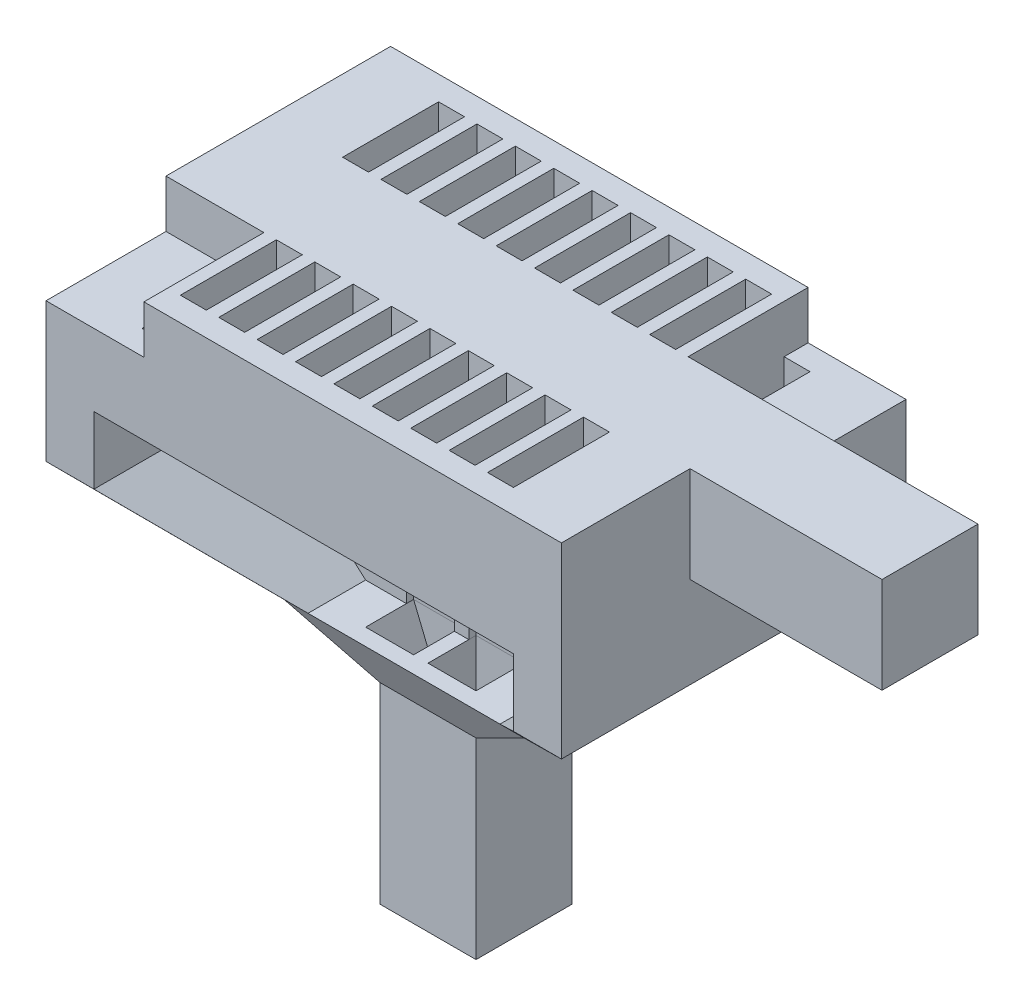
from build123d import *

# Parameters (mm, degrees)
MAIN_BLOCK_W               = 5.37
MAIN_BLOCK_H               = 3.59
MAIN_WELL_BLOCK_DEPTH      = 1.25
WELL_SKETCH_W              = 0.27
WELL_SKETCH_H              = 1
WELLS_DEPTH                = 2.54
SUPPORT_BEAMS_W            = 0.5
SUPPORT_BEAMS_H            = 3.59
SUPPORT_BEAMS_EXTR_DEPTH   = 0.7
WALL_DIVIDER_SKETCH_W      = 4.37
WALL_DIVIDER_SKETCH_H      = 0.3
DIVIDER_WALL_EXTR_DEPTH    = 0.7
LOWER_EXIT_BASE_SKETCH_2_W = 1
LOWER_EXIT_BASE_SKETCH_2_H = 1
TETRODE_GUIDE_TUBE_DEPTH   = 2
MID_TETRODE_HOLES_6_W      = 0.32
MID_TETRODE_HOLES_6_H      = 0.32
CUT_EXTRUDE3_DEPTH         = 2
TETRODE_GUIDE_TOP_8_W      = 0.5
TETRODE_GUIDE_TOP_8_H      = 0.5
CUT_EXTRUDE4_DEPTH         = 0.5
SKETCH9_W                  = 1.020059297
SKETCH9_H                  = 1.25
SKETCH9_W_2                = 1.02
GND_EXTR_DEPTH             = 0.5
SKETCH10_W                 = 1
SKETCH10_H                 = 1
CONNECTOR_ARM_DEPTH        = 2


with BuildPart() as part:
    # main block → Main Well Block (new body)
    with BuildSketch(Plane(origin=(0, 0, 0), x_dir=(1, 0, 0), z_dir=(0, 1, 0))):
        Rectangle(MAIN_BLOCK_W, MAIN_BLOCK_H)
    extrude(amount=-MAIN_WELL_BLOCK_DEPTH)

    # well sketch → wells (cut)
    with BuildSketch(Plane(origin=(0, 0, 0), x_dir=(1, 0, 0), z_dir=(0, 1, 0))):
        with Locations((1.8, 1.045)):
            Rectangle(WELL_SKETCH_W, WELL_SKETCH_H)
        with Locations((1.400006589, 1.045)):
            Rectangle(WELL_SKETCH_W, WELL_SKETCH_H)
        with Locations((1.000013177, 1.045)):
            Rectangle(WELL_SKETCH_W, WELL_SKETCH_H)
        with Locations((0.600019766, 1.045)):
            Rectangle(WELL_SKETCH_W, WELL_SKETCH_H)
        with Locations((0.200026354, 1.045)):
            Rectangle(WELL_SKETCH_W, WELL_SKETCH_H)
        with Locations((-0.199967057, 1.045)):
            Rectangle(WELL_SKETCH_W, WELL_SKETCH_H)
        with Locations((-0.599960468, 1.045)):
            Rectangle(WELL_SKETCH_W, WELL_SKETCH_H)
        with Locations((-0.99995388, 1.045)):
            Rectangle(WELL_SKETCH_W, WELL_SKETCH_H)
        with Locations((-1.399947291, 1.045)):
            Rectangle(WELL_SKETCH_W, WELL_SKETCH_H)
        with Locations((-1.799940703, 1.045)):
            Rectangle(WELL_SKETCH_W, WELL_SKETCH_H)
        with Locations((1.400006589, -1.045)):
            Rectangle(WELL_SKETCH_W, WELL_SKETCH_H)
        with Locations((1.000013177, -1.045)):
            Rectangle(WELL_SKETCH_W, WELL_SKETCH_H)
        with Locations((0.600019766, -1.045)):
            Rectangle(WELL_SKETCH_W, WELL_SKETCH_H)
        with Locations((0.200026354, -1.045)):
            Rectangle(WELL_SKETCH_W, WELL_SKETCH_H)
        with Locations((-0.199967057, -1.045)):
            Rectangle(WELL_SKETCH_W, WELL_SKETCH_H)
        with Locations((-0.599960468, -1.045)):
            Rectangle(WELL_SKETCH_W, WELL_SKETCH_H)
        with Locations((-0.99995388, -1.045)):
            Rectangle(WELL_SKETCH_W, WELL_SKETCH_H)
        with Locations((-1.399947291, -1.045)):
            Rectangle(WELL_SKETCH_W, WELL_SKETCH_H)
        with Locations((-1.799940703, -1.045)):
            Rectangle(WELL_SKETCH_W, WELL_SKETCH_H)
        with Locations((1.8, -1.045)):
            Rectangle(WELL_SKETCH_W, WELL_SKETCH_H)
    extrude(amount=-WELLS_DEPTH, mode=Mode.SUBTRACT)

    # support beams → support beams extr (add)
    with BuildSketch(Plane.XZ.offset(1.25)):
        with Locations((-2.435, 0)):
            Rectangle(SUPPORT_BEAMS_W, SUPPORT_BEAMS_H)
        with Locations((2.435, 0)):
            Rectangle(SUPPORT_BEAMS_W, SUPPORT_BEAMS_H)
    extrude(amount=SUPPORT_BEAMS_EXTR_DEPTH)

    # Sketch6 → section 1 of arm1
    with BuildSketch(Plane(origin=(0, -3, 0), x_dir=(1, 0, 0), z_dir=(0, 1, 0)), mode=Mode.PRIVATE) as arm1_s1:
        with BuildLine():
            Line((-1.25, 0.75), (-1, 0.75))
            Line((-1, 0.75), (-1, -0.75))
            Line((-1, -0.75), (-1.25, -0.75))
            Line((-1.25, -0.75), (-1.25, 0.75))
        make_face()
    # loft from a face of the part (arm1)
    loft([part.faces().sort_by_distance((-2.435, -1.95, 0))[0], arm1_s1.sketch])

    # Sketch7 → section 0 of arm2
    with BuildSketch(Plane(origin=(0, -3, 0), x_dir=(1, 0, 0), z_dir=(0, 1, 0)), mode=Mode.PRIVATE) as arm2_s0:
        with BuildLine():
            Line((1.25, 0.75), (1, 0.75))
            Line((1, 0.75), (1, -0.75))
            Line((1, -0.75), (1.25, -0.75))
            Line((1.25, -0.75), (1.25, 0.75))
        make_face()
    # loft up to a face of the part (arm2)
    loft([arm2_s0.sketch, part.faces().sort_by_distance((2.435, -1.95, 0))[0]])

    # wall divider sketch → divider wall extr (add)
    with BuildSketch(Plane(origin=(0, -1.25, 0), x_dir=(-1, 0, 0), z_dir=(0, -1, 0))):
        Rectangle(WALL_DIVIDER_SKETCH_W, WALL_DIVIDER_SKETCH_H)
    extrude(amount=DIVIDER_WALL_EXTR_DEPTH)

    # Sketch8 → section 1 of divider_wall
    with BuildSketch(Plane(origin=(0, -3, 0), x_dir=(1, 0, 0), z_dir=(0, 1, 0)), mode=Mode.PRIVATE) as divider_wall_s1:
        with BuildLine():
            Line((1.25, 0.15), (-1.25, 0.15))
            Line((-1.25, 0.15), (-1.25, -0.15))
            Line((-1.25, -0.15), (1.25, -0.15))
            Line((1.25, -0.15), (1.25, 0.15))
        make_face()
    # loft from a face of the part (divider_wall)
    loft([part.faces().sort_by_distance((0, -1.95, 0))[0], divider_wall_s1.sketch])

    # lower exit base sketch → exit base section 0
    with BuildSketch(Plane(origin=(0, -3.5, 0), x_dir=(1, 0, 0), z_dir=(0, 1, 0))):
        with BuildLine():
            Line((0.5, 0.5), (-0.5, 0.5))
            Line((-0.5, 0.5), (-0.5, -0.5))
            Line((-0.5, -0.5), (0.5, -0.5))
            Line((0.5, -0.5), (0.5, 0.5))
        make_face()
    # exit base sketch → exit base section 1
    with BuildSketch(Plane(origin=(0, -3, 0), x_dir=(1, 0, 0), z_dir=(0, 1, 0))):
        with BuildLine():
            Line((1.25, 0.75), (-1.25, 0.75))
            Line((-1.25, 0.75), (-1.25, -0.75))
            Line((-1.25, -0.75), (1.25, -0.75))
            Line((1.25, -0.75), (1.25, 0.75))
        make_face()
    loft()

    # lower exit base sketch<2> → tetrode guide tube (add)
    with BuildSketch(Plane(origin=(0, -3.5, 0), x_dir=(1, 0, 0), z_dir=(0, 1, 0))):
        Rectangle(LOWER_EXIT_BASE_SKETCH_2_W, LOWER_EXIT_BASE_SKETCH_2_H)
    extrude(amount=-TETRODE_GUIDE_TUBE_DEPTH)

    # mid tetrode holes → tet1 section 0
    with BuildSketch(Plane(origin=(0, -3.5, 0), x_dir=(1, 0, 0), z_dir=(0, 1, 0))):
        with BuildLine():
            Line((0.385, -0.065), (0.065, -0.065))
            Line((0.065, -0.065), (0.065, -0.385))
            Line((0.065, -0.385), (0.385, -0.385))
            Line((0.385, -0.385), (0.385, -0.065))
        make_face()
    # tetrode guide top → tet1 section 1
    with BuildSketch(Plane(origin=(0, -3, 0), x_dir=(1, 0, 0), z_dir=(0, 1, 0))):
        with BuildLine():
            Line((0.575, -0.075), (0.075, -0.075))
            Line((0.075, -0.075), (0.075, -0.575))
            Line((0.075, -0.575), (0.575, -0.575))
            Line((0.575, -0.575), (0.575, -0.075))
        make_face()
    loft(mode=Mode.SUBTRACT)

    # tetrode guide top<11> → tet2 section 0
    with BuildSketch(Plane(origin=(0, -3, 0), x_dir=(1, 0, 0), z_dir=(0, 1, 0))):
        with BuildLine():
            Line((-0.575, -0.075), (-0.075, -0.075))
            Line((-0.075, -0.075), (-0.075, -0.575))
            Line((-0.075, -0.575), (-0.575, -0.575))
            Line((-0.575, -0.575), (-0.575, -0.075))
        make_face()
    # mid tetrode holes<9> → tet2 section 1
    with BuildSketch(Plane(origin=(0, -3.5, 0), x_dir=(1, 0, 0), z_dir=(0, 1, 0))):
        with BuildLine():
            Line((-0.065, -0.065), (-0.385, -0.065))
            Line((-0.385, -0.065), (-0.385, -0.385))
            Line((-0.385, -0.385), (-0.065, -0.385))
            Line((-0.065, -0.385), (-0.065, -0.065))
        make_face()
    loft(mode=Mode.SUBTRACT)

    # tetrode guide top<12> → tet3 section 0
    with BuildSketch(Plane(origin=(0, -3, 0), x_dir=(1, 0, 0), z_dir=(0, 1, 0))):
        with BuildLine():
            Line((-0.075, 0.575), (-0.575, 0.575))
            Line((-0.575, 0.575), (-0.575, 0.075))
            Line((-0.575, 0.075), (-0.075, 0.075))
            Line((-0.075, 0.075), (-0.075, 0.575))
        make_face()
    # mid tetrode holes<10> → tet3 section 1
    with BuildSketch(Plane(origin=(0, -3.5, 0), x_dir=(1, 0, 0), z_dir=(0, 1, 0))):
        with BuildLine():
            Line((-0.065, 0.385), (-0.385, 0.385))
            Line((-0.385, 0.385), (-0.385, 0.065))
            Line((-0.385, 0.065), (-0.065, 0.065))
            Line((-0.065, 0.065), (-0.065, 0.385))
        make_face()
    loft(mode=Mode.SUBTRACT)

    # tetrode guide top<13> → tet4 section 0
    with BuildSketch(Plane(origin=(0, -3, 0), x_dir=(1, 0, 0), z_dir=(0, 1, 0))):
        with BuildLine():
            Line((0.075, 0.575), (0.575, 0.575))
            Line((0.575, 0.575), (0.575, 0.075))
            Line((0.575, 0.075), (0.075, 0.075))
            Line((0.075, 0.075), (0.075, 0.575))
        make_face()
    # mid tetrode holes<11> → tet4 section 1
    with BuildSketch(Plane(origin=(0, -3.5, 0), x_dir=(1, 0, 0), z_dir=(0, 1, 0))):
        with BuildLine():
            Line((0.385, 0.385), (0.065, 0.385))
            Line((0.065, 0.385), (0.065, 0.065))
            Line((0.065, 0.065), (0.385, 0.065))
            Line((0.385, 0.065), (0.385, 0.385))
        make_face()
    loft(mode=Mode.SUBTRACT)

    # mid tetrode holes<6> → Cut-Extrude3 (cut)
    with BuildSketch(Plane(origin=(0, -3.5, 0), x_dir=(1, 0, 0), z_dir=(0, 1, 0))):
        with Locations((-0.225, -0.225)):
            Rectangle(MID_TETRODE_HOLES_6_W, MID_TETRODE_HOLES_6_H)
        with Locations((0.225, -0.225)):
            Rectangle(MID_TETRODE_HOLES_6_W, MID_TETRODE_HOLES_6_H)
        with Locations((0.225, 0.225)):
            Rectangle(MID_TETRODE_HOLES_6_W, MID_TETRODE_HOLES_6_H)
        with Locations((-0.225, 0.225)):
            Rectangle(MID_TETRODE_HOLES_6_W, MID_TETRODE_HOLES_6_H)
    extrude(amount=-CUT_EXTRUDE3_DEPTH, mode=Mode.SUBTRACT)

    # tetrode guide top<8> → Cut-Extrude4 (cut)
    with BuildSketch(Plane(origin=(0, -3, 0), x_dir=(1, 0, 0), z_dir=(0, 1, 0))):
        with Locations((0.325, -0.325)):
            Rectangle(TETRODE_GUIDE_TOP_8_W, TETRODE_GUIDE_TOP_8_H)
        with Locations((-0.325, -0.325)):
            Rectangle(TETRODE_GUIDE_TOP_8_W, TETRODE_GUIDE_TOP_8_H)
        with Locations((0.325, 0.325)):
            Rectangle(TETRODE_GUIDE_TOP_8_W, TETRODE_GUIDE_TOP_8_H)
        with Locations((-0.325, 0.325)):
            Rectangle(TETRODE_GUIDE_TOP_8_W, TETRODE_GUIDE_TOP_8_H)
    extrude(amount=CUT_EXTRUDE4_DEPTH, mode=Mode.SUBTRACT)

    # Sketch9 → gnd_extr (cut)
    with BuildSketch(Plane(origin=(0, 0, 0), x_dir=(1, 0, 0), z_dir=(0, 1, 0))):
        with Locations((-2.174970351, -1.17)):
            Rectangle(SKETCH9_W, SKETCH9_H)
        with Locations((2.175, 1.17)):
            Rectangle(SKETCH9_W_2, SKETCH9_H)
    extrude(amount=-GND_EXTR_DEPTH, mode=Mode.SUBTRACT)

    # Sketch10 → connector_arm (add)
    with BuildSketch(Plane(origin=(2.685, 0, 0), x_dir=(0, 0, -1), z_dir=(1, 0, 0))):
        with Locations((0.045, -0.5)):
            Rectangle(SKETCH10_W, SKETCH10_H)
    extrude(amount=CONNECTOR_ARM_DEPTH)


solid = part.part
